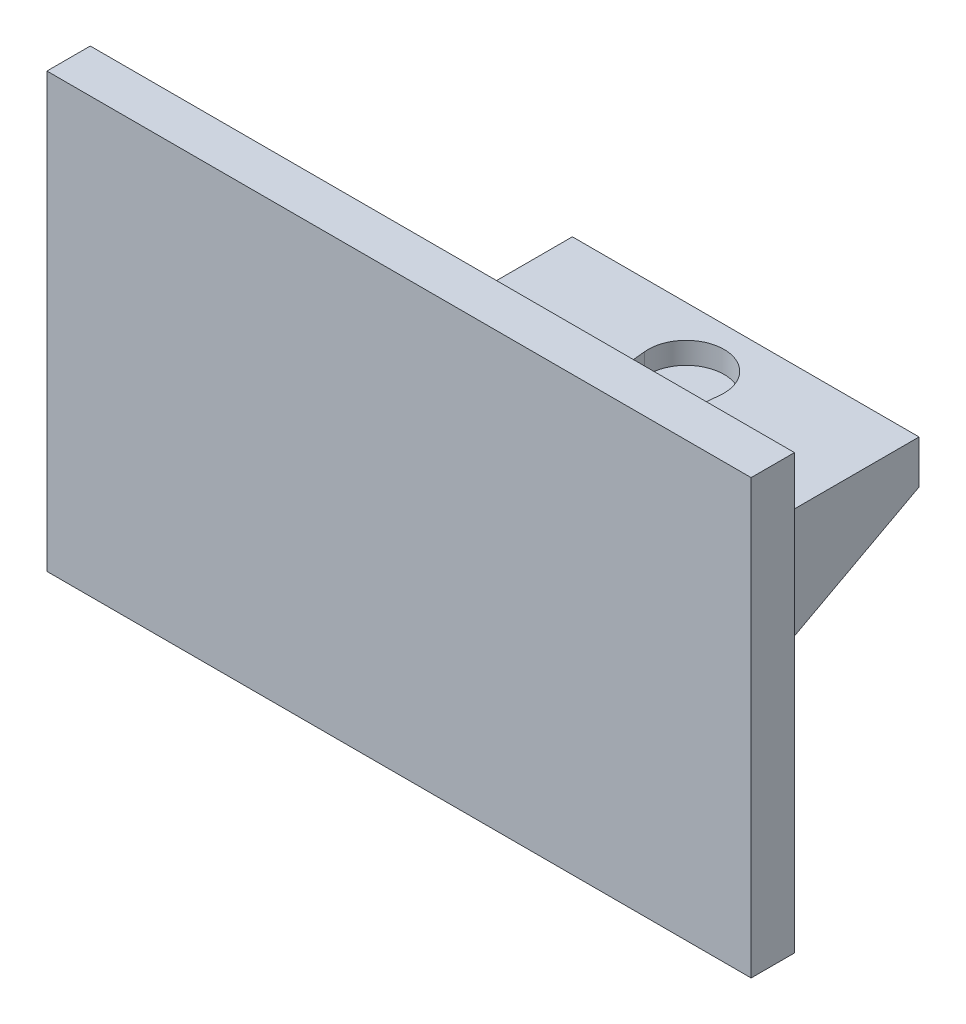
from build123d import *

# Parameters (mm, degrees)
SKETCH_1_W               = 24
SKETCH_1_H               = 28
EXTRUDE_2_DEPTH          = 4
SKETCH_1_5_R             = 0.5
EXTRUDE_4_DEPTH          = 2
EXTRUDE_5_DEPTH          = 25
EXTRUDE_5_DEPTH_BACK     = 15
CUT_EXTRUDE_1_DEPTH      = 54.490653389
CUT_EXTRUDE_1_DEPTH_BACK = 54.490653389
CUT_EXTRUDE_2_DEPTH      = 54.490653389
CUT_EXTRUDE_2_DEPTH_BACK = 54.490653389
CUT_EXTRUDE_4_DEPTH      = 54.490653389
CUT_EXTRUDE_4_DEPTH_BACK = 54.490653389


with BuildPart() as part:
    # 草图1 → 凸台-拉伸2 (new body)
    with BuildSketch(Plane(origin=(0, 0, 0), x_dir=(1, 0, 0), z_dir=(0, 1, 0))):
        with Locations((0, 2)):
            Rectangle(SKETCH_1_W, SKETCH_1_H)
        with BuildLine():
            Line((-1.989974874, -4.7), (-3.48245603, 10.15))
            ThreePointArc((-3.48245603, 10.15), (-0.175219713, 13.995611256), (3.5, 10.5))
            ThreePointArc((3.5, 10.5), (3.495611256, 10.324780287), (3.48245603, 10.15))
            Line((3.48245603, 10.15), (1.989974874, -4.7))
            ThreePointArc((1.989974874, -4.7), (0, -6.5), (-1.989974874, -4.7))
        make_face(mode=Mode.SUBTRACT)
    extrude(amount=EXTRUDE_2_DEPTH)

    # 草图1<5> → 凸台-拉伸4 (add)
    with BuildSketch(Plane(origin=(0, 0, 0), x_dir=(1, 0, 0), z_dir=(0, 1, 0))):
        with BuildLine():
            Line((1.989974874, -4.7), (3.48245603, 10.15))
            ThreePointArc((3.48245603, 10.15), (0, 14), (-3.48245603, 10.15))
            Line((-3.48245603, 10.15), (-1.989974874, -4.7))
            ThreePointArc((-1.989974874, -4.7), (0, -6.5), (1.989974874, -4.7))
        make_face()
        with Locations((0, -2.5)):
            Circle(SKETCH_1_5_R, mode=Mode.SUBTRACT)
    extrude(amount=EXTRUDE_4_DEPTH)

    # 草图1<6> → 凸台-拉伸5 (add, two sides: drawn at the far end of the back side and taken through both)
    with BuildSketch(Plane(origin=(0, 0, 0), x_dir=(1, 0, 0), z_dir=(0, 1, 0)).offset(-EXTRUDE_5_DEPTH_BACK)):
        Polygon((-12, 16), (-16, 16), (-16, -12), (-32.5, -12), (-32.5, -16), (32.5, -16), (32.5, -12), (16, -12), (16, 16), (12, 16), (12, -12), (-12, -12), align=None)
    extrude(amount=EXTRUDE_5_DEPTH + EXTRUDE_5_DEPTH_BACK)

    # 草图5 → 切除-拉伸1 (cut, two sides: drawn at the far end of the back side and taken through both)
    with BuildSketch(Plane.ZY.offset(-12).offset(-CUT_EXTRUDE_1_DEPTH_BACK)):
        Polygon((-16, 4), (12, 25), (-16, 25), align=None)
    extrude(amount=CUT_EXTRUDE_1_DEPTH + CUT_EXTRUDE_1_DEPTH_BACK, mode=Mode.SUBTRACT)

    # 草图6 → 切除-拉伸2 (cut, two sides: drawn at the far end of the back side and taken through both)
    with BuildSketch(Plane.ZY.offset(-12).offset(-CUT_EXTRUDE_2_DEPTH_BACK)):
        Polygon((-16, 0), (12, -15), (-16, -15), align=None)
    extrude(amount=CUT_EXTRUDE_2_DEPTH + CUT_EXTRUDE_2_DEPTH_BACK, mode=Mode.SUBTRACT)

    # 草图8 → 切除-拉伸4 (cut, two sides: drawn at the far end of the back side and taken through both)
    with BuildSketch(Plane.ZY.offset(-12).offset(-CUT_EXTRUDE_4_DEPTH_BACK)):
        Polygon((4.5, 4), (-16, 4), (0.673039493, 16.50477962), (12, 25), align=None)
    extrude(amount=CUT_EXTRUDE_4_DEPTH + CUT_EXTRUDE_4_DEPTH_BACK, mode=Mode.SUBTRACT)


solid = part.part
